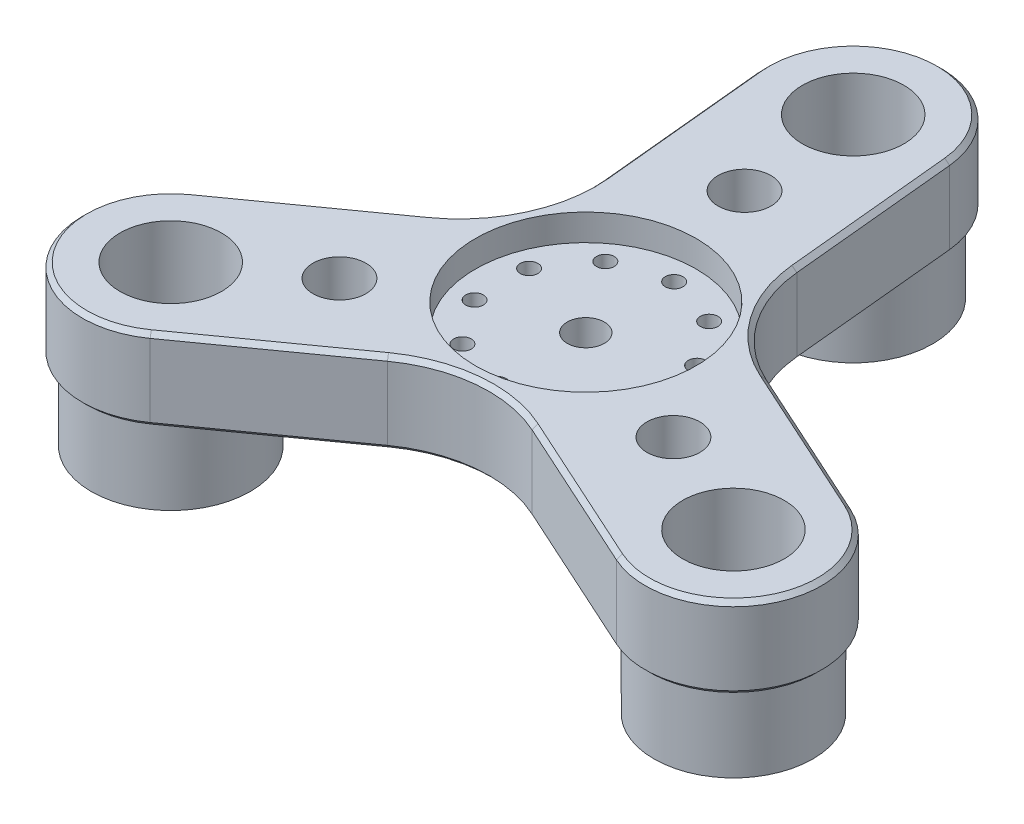
from build123d import *

# Parameters (mm, degrees)
SKETCH_1_R           = 10
EXTRUDE_1_DEPTH      = 9.25
CUT_EXTRUDE_1_REACH  = 62.295
SKETCH_2_R           = 4.5
SKETCH_3_R           = 9
EXTRUDE_2_DEPTH      = 9.5
CUT_EXTRUDE_2_REACH  = 62.334
SKETCH_4_R           = 4.5
FILLET_1_R           = 15
SKETCH_6_R           = 12.5
CUT_EXTRUDE_5_DEPTH  = 3
CHAMFER_1_SIZE       = 0.5
CHAMFER_2_SIZE       = 0.5
SKETCH_7_R           = 4.71
EXTRUDE_3_DEPTH      = 2.5
CUT_EXTRUDE_6_REACH  = 63.628
SKETCH_8_R           = 1
CUT_EXTRUDE_7_REACH  = 62.729
SKETCH_9_R           = 2.1
CUT_EXTRUDE_9_REACH  = 64.462
SKETCH_10_R          = 3
CUT_EXTRUDE_10_REACH = 64.462
SKETCH_11_R          = 5.75
CUT_EXTRUDE_START    = -0.75
SKETCH_12_R          = 9
SKETCH_12_R_2        = 5.75
CUT_EXTRUDE_11_DEPTH = 0.75


with BuildPart() as part:
    # ｽｹｯﾁ1 → ﾎﾞｽ - 押し出し1 (new body)
    with BuildSketch(Plane(origin=(0, 0, 0), x_dir=(1, 0, 0), z_dir=(0, 1, 0))):
        with Locations((-3.254321183, 33.539013848)):
            Circle(SKETCH_1_R)
        with BuildLine():
            ThreePointArc((6.745678817, 33.539013848), (-2.770869168, 23.550706977), (-13.207576013, 32.57324043))
            Line((-13.207576013, 32.57324043), (-10.510844372, 4.780740937))
            Line((-10.510844372, 4.780740937), (-33.231489148, -11.450946917))
            ThreePointArc((-33.231489148, -11.450946917), (-22.84300571, -10.695978242), (-17.418477419, -19.587831741))
            ThreePointArc((-17.418477419, -19.587831741), (-18.52662392, -24.163303449), (-21.60546569, -27.724716565))
            Line((-21.60546569, -27.724716565), (1.115179086, -11.493028711))
            Line((1.115179086, -11.493028711), (26.532555501, -23.053840349))
            ThreePointArc((26.532555501, -23.053840349), (21.57014036, -9.810939007), (34.813041703, -4.848523866))
            Line((34.813041703, -4.848523866), (9.395665287, 6.712287773))
            Line((9.395665287, 6.712287773), (6.698933646, 34.504787266))
            ThreePointArc((6.698933646, 34.504787266), (6.733985688, 34.022465864), (6.745678817, 33.539013848))
        make_face()
        with Locations((30.672798602, -13.951182107)):
            Circle(SKETCH_1_R)
        with Locations((-27.418477419, -19.587831741)):
            Circle(SKETCH_1_R)
    extrude(amount=EXTRUDE_1_DEPTH)

    # ｽｹｯﾁ2 → ｶｯﾄ - 押し出し1 (cut, up to next)
    with BuildSketch(Plane(origin=(0, 9.25, 0), x_dir=(1, 0, 0), z_dir=(0, 1, 0)), mode=Mode.PRIVATE) as cut_extrude_1_sk1:
        with Locations(Location((-27.418477419, -19.587831741, 0), (0, 0, 270))):
            Circle(SKETCH_2_R)
    cut_extrude_1_tool1 = extrude(cut_extrude_1_sk1.sketch, amount=-CUT_EXTRUDE_1_REACH, mode=Mode.PRIVATE) & part.part
    # ｽｹｯﾁ2 → ｶｯﾄ - 押し出し1 (cut, up to next)
    with BuildSketch(Plane(origin=(0, 9.25, 0), x_dir=(1, 0, 0), z_dir=(0, 1, 0)), mode=Mode.PRIVATE) as cut_extrude_1_sk2:
        with Locations(Location((-3.254321183, 33.539013848, 0), (0, 0, 270))):
            Circle(SKETCH_2_R)
    cut_extrude_1_tool2 = extrude(cut_extrude_1_sk2.sketch, amount=-CUT_EXTRUDE_1_REACH, mode=Mode.PRIVATE) & part.part
    # ｽｹｯﾁ2 → ｶｯﾄ - 押し出し1 (cut, up to next)
    with BuildSketch(Plane(origin=(0, 9.25, 0), x_dir=(1, 0, 0), z_dir=(0, 1, 0)), mode=Mode.PRIVATE) as cut_extrude_1_sk3:
        with Locations(Location((30.672798602, -13.951182107, 0), (0, 0, 270))):
            Circle(SKETCH_2_R)
    cut_extrude_1_tool3 = extrude(cut_extrude_1_sk3.sketch, amount=-CUT_EXTRUDE_1_REACH, mode=Mode.PRIVATE) & part.part
    add(cut_extrude_1_tool1.solids().sort_by_distance((-27.418477, 9.25, 19.587832))[0], mode=Mode.SUBTRACT)
    add(cut_extrude_1_tool2.solids().sort_by_distance((-3.254321, 9.25, -33.539014))[0], mode=Mode.SUBTRACT)
    add(cut_extrude_1_tool3.solids().sort_by_distance((30.672799, 9.25, 13.951182))[0], mode=Mode.SUBTRACT)

    # ｽｹｯﾁ3 → ﾎﾞｽ - 押し出し2 (add)
    with BuildSketch(Plane.XZ):
        with Locations(Location((-3.254321183, -33.539013848, 0), (0, 0, 90))):
            Circle(SKETCH_3_R)
        with Locations(Location((-27.418477419, 19.587831741, 0), (0, 0, 90))):
            Circle(SKETCH_3_R)
        with Locations(Location((30.672798602, 13.951182107, 0), (0, 0, 90))):
            Circle(SKETCH_3_R)
    extrude(amount=EXTRUDE_2_DEPTH)

    # ｽｹｯﾁ4 → ｶｯﾄ - 押し出し2 (cut, up to next)
    with BuildSketch(Plane(origin=(0, 0, 0), x_dir=(1, 0, 0), z_dir=(0, 1, 0)), mode=Mode.PRIVATE) as cut_extrude_2_sk1:
        with Locations(Location((-3.254321183, 33.539013848, 0), (0, 0, 270))):
            Circle(SKETCH_4_R)
    cut_extrude_2_tool1 = extrude(cut_extrude_2_sk1.sketch, amount=-CUT_EXTRUDE_2_REACH, mode=Mode.PRIVATE) & part.part
    # ｽｹｯﾁ4 → ｶｯﾄ - 押し出し2 (cut, up to next)
    with BuildSketch(Plane(origin=(0, 0, 0), x_dir=(1, 0, 0), z_dir=(0, 1, 0)), mode=Mode.PRIVATE) as cut_extrude_2_sk2:
        with Locations(Location((30.672798602, -13.951182107, 0), (0, 0, 270))):
            Circle(SKETCH_4_R)
    cut_extrude_2_tool2 = extrude(cut_extrude_2_sk2.sketch, amount=-CUT_EXTRUDE_2_REACH, mode=Mode.PRIVATE) & part.part
    # ｽｹｯﾁ4 → ｶｯﾄ - 押し出し2 (cut, up to next)
    with BuildSketch(Plane(origin=(0, 0, 0), x_dir=(1, 0, 0), z_dir=(0, 1, 0)), mode=Mode.PRIVATE) as cut_extrude_2_sk3:
        with Locations(Location((-27.418477419, -19.587831741, 0), (0, 0, 270))):
            Circle(SKETCH_4_R)
    cut_extrude_2_tool3 = extrude(cut_extrude_2_sk3.sketch, amount=-CUT_EXTRUDE_2_REACH, mode=Mode.PRIVATE) & part.part
    add(cut_extrude_2_tool1.solids().sort_by_distance((-3.254321, 0, -33.539014))[0], mode=Mode.SUBTRACT)
    add(cut_extrude_2_tool2.solids().sort_by_distance((30.672799, 0, 13.951182))[0], mode=Mode.SUBTRACT)
    add(cut_extrude_2_tool3.solids().sort_by_distance((-27.418477, 0, 19.587832))[0], mode=Mode.SUBTRACT)

    # ﾌｨﾚｯﾄ1
    fillet_1_edges = [part.edges().sort_by_distance(p)[0] for p in [
        (9.395665287, 4.625, -6.712287773),
        (1.115179086, 4.625, 11.493028711),
        (-10.510844372, 4.625, -4.780740937),
    ]]
    fillet(fillet_1_edges, radius=FILLET_1_R)

    # ｽｹｯﾁ6 → ｶｯﾄ - 押し出し5 (cut)
    with BuildSketch(Plane(origin=(0, 9.25, 0), x_dir=(1, 0, 0), z_dir=(0, 1, 0))):
        with Locations(Location((0, 0, 0), (0, 0, 270))):
            Circle(SKETCH_6_R)
    extrude(amount=-CUT_EXTRUDE_5_DEPTH, mode=Mode.SUBTRACT)

    # 面取り1
    chamfer_1_edges = [part.edges().sort_by_distance(p)[0] for p in [
        (-12.27740235, 9.25, -22.98687645),
        (-25.394541243, 9.25, 5.852210905),
        (-35.555362243, 9.25, 25.40084347),
        (-13.768517785, 9.25, 22.125980553),
        (17.765433933, 9.25, 19.066212381),
        (39.775456844, 9.25, 18.091425208),
        (26.045920135, 9.25, 0.860895898),
        (7.62910731, 9.25, -24.918423286),
        (-4.220094601, 9.25, -43.492268678),
        (11.283835981, 9.25, -8.061201839),
        (1.339287587, 9.25, 13.802689532),
        (-12.623123569, 9.25, -5.741487692),
    ]]
    chamfer(chamfer_1_edges, length=CHAMFER_1_SIZE)

    # 面取り2
    chamfer_2_edges = [part.edges().sort_by_distance(p)[0] for p in [
        (39.775456844, 0, 18.091425208),
        (17.765433933, 0, 19.066212381),
        (-13.768517785, 0, 22.125980553),
        (-35.555362243, 0, 25.40084347),
        (-25.394541243, 0, 5.852210905),
        (-12.27740235, 0, -22.98687645),
        (-4.220094601, 0, -43.492268678),
        (7.62910731, 0, -24.918423286),
        (11.283835981, 0, -8.061201839),
        (1.339287587, 0, 13.802689532),
        (-12.623123569, 0, -5.741487692),
        (26.045920135, 0, 0.860895898),
    ]]
    chamfer(chamfer_2_edges, length=CHAMFER_2_SIZE)

    # ｽｹｯﾁ7 → ﾎﾞｽ - 押し出し3 (add)
    with BuildSketch(Plane.XZ):
        with Locations(Location((0, 0, 0), (0, 0, 90))):
            Circle(SKETCH_7_R)
    extrude(amount=EXTRUDE_3_DEPTH)

    # ｽｹｯﾁ8 → ｶｯﾄ - 押し出し6 (cut, up to next)
    with BuildSketch(Plane(origin=(0, 6.25, 0), x_dir=(1, 0, 0), z_dir=(0, 1, 0)), mode=Mode.PRIVATE) as cut_extrude_6_sk1:
        with Locations(Location((0, 10, 0), (0, 0, 270))):
            Circle(SKETCH_8_R)
    cut_extrude_6_tool1 = extrude(cut_extrude_6_sk1.sketch, amount=-CUT_EXTRUDE_6_REACH, mode=Mode.PRIVATE) & part.part
    # ｽｹｯﾁ8 → ｶｯﾄ - 押し出し6 (cut, up to next)
    with BuildSketch(Plane(origin=(0, 6.25, 0), x_dir=(1, 0, 0), z_dir=(0, 1, 0)), mode=Mode.PRIVATE) as cut_extrude_6_sk2:
        with Locations(Location((5.877852523, 8.090169944, 0), (0, 0, 270))):
            Circle(SKETCH_8_R)
    cut_extrude_6_tool2 = extrude(cut_extrude_6_sk2.sketch, amount=-CUT_EXTRUDE_6_REACH, mode=Mode.PRIVATE) & part.part
    # ｽｹｯﾁ8 → ｶｯﾄ - 押し出し6 (cut, up to next)
    with BuildSketch(Plane(origin=(0, 6.25, 0), x_dir=(1, 0, 0), z_dir=(0, 1, 0)), mode=Mode.PRIVATE) as cut_extrude_6_sk3:
        with Locations(Location((9.510565163, 3.090169944, 0), (0, 0, 270))):
            Circle(SKETCH_8_R)
    cut_extrude_6_tool3 = extrude(cut_extrude_6_sk3.sketch, amount=-CUT_EXTRUDE_6_REACH, mode=Mode.PRIVATE) & part.part
    # ｽｹｯﾁ8 → ｶｯﾄ - 押し出し6 (cut, up to next)
    with BuildSketch(Plane(origin=(0, 6.25, 0), x_dir=(1, 0, 0), z_dir=(0, 1, 0)), mode=Mode.PRIVATE) as cut_extrude_6_sk4:
        with Locations(Location((9.510565163, -3.090169944, 0), (0, 0, 270))):
            Circle(SKETCH_8_R)
    cut_extrude_6_tool4 = extrude(cut_extrude_6_sk4.sketch, amount=-CUT_EXTRUDE_6_REACH, mode=Mode.PRIVATE) & part.part
    # ｽｹｯﾁ8 → ｶｯﾄ - 押し出し6 (cut, up to next)
    with BuildSketch(Plane(origin=(0, 6.25, 0), x_dir=(1, 0, 0), z_dir=(0, 1, 0)), mode=Mode.PRIVATE) as cut_extrude_6_sk5:
        with Locations(Location((5.877852523, -8.090169944, 0), (0, 0, 270))):
            Circle(SKETCH_8_R)
    cut_extrude_6_tool5 = extrude(cut_extrude_6_sk5.sketch, amount=-CUT_EXTRUDE_6_REACH, mode=Mode.PRIVATE) & part.part
    # ｽｹｯﾁ8 → ｶｯﾄ - 押し出し6 (cut, up to next)
    with BuildSketch(Plane(origin=(0, 6.25, 0), x_dir=(1, 0, 0), z_dir=(0, 1, 0)), mode=Mode.PRIVATE) as cut_extrude_6_sk6:
        with Locations(Location((0, -10, 0), (0, 0, 270))):
            Circle(SKETCH_8_R)
    cut_extrude_6_tool6 = extrude(cut_extrude_6_sk6.sketch, amount=-CUT_EXTRUDE_6_REACH, mode=Mode.PRIVATE) & part.part
    # ｽｹｯﾁ8 → ｶｯﾄ - 押し出し6 (cut, up to next)
    with BuildSketch(Plane(origin=(0, 6.25, 0), x_dir=(1, 0, 0), z_dir=(0, 1, 0)), mode=Mode.PRIVATE) as cut_extrude_6_sk7:
        with Locations(Location((-5.877852523, -8.090169944, 0), (0, 0, 270))):
            Circle(SKETCH_8_R)
    cut_extrude_6_tool7 = extrude(cut_extrude_6_sk7.sketch, amount=-CUT_EXTRUDE_6_REACH, mode=Mode.PRIVATE) & part.part
    # ｽｹｯﾁ8 → ｶｯﾄ - 押し出し6 (cut, up to next)
    with BuildSketch(Plane(origin=(0, 6.25, 0), x_dir=(1, 0, 0), z_dir=(0, 1, 0)), mode=Mode.PRIVATE) as cut_extrude_6_sk8:
        with Locations(Location((-9.510565163, -3.090169944, 0), (0, 0, 270))):
            Circle(SKETCH_8_R)
    cut_extrude_6_tool8 = extrude(cut_extrude_6_sk8.sketch, amount=-CUT_EXTRUDE_6_REACH, mode=Mode.PRIVATE) & part.part
    # ｽｹｯﾁ8 → ｶｯﾄ - 押し出し6 (cut, up to next)
    with BuildSketch(Plane(origin=(0, 6.25, 0), x_dir=(1, 0, 0), z_dir=(0, 1, 0)), mode=Mode.PRIVATE) as cut_extrude_6_sk9:
        with Locations(Location((-9.510565163, 3.090169944, 0), (0, 0, 270))):
            Circle(SKETCH_8_R)
    cut_extrude_6_tool9 = extrude(cut_extrude_6_sk9.sketch, amount=-CUT_EXTRUDE_6_REACH, mode=Mode.PRIVATE) & part.part
    # ｽｹｯﾁ8 → ｶｯﾄ - 押し出し6 (cut, up to next)
    with BuildSketch(Plane(origin=(0, 6.25, 0), x_dir=(1, 0, 0), z_dir=(0, 1, 0)), mode=Mode.PRIVATE) as cut_extrude_6_sk10:
        with Locations(Location((-5.877852523, 8.090169944, 0), (0, 0, 270))):
            Circle(SKETCH_8_R)
    cut_extrude_6_tool10 = extrude(cut_extrude_6_sk10.sketch, amount=-CUT_EXTRUDE_6_REACH, mode=Mode.PRIVATE) & part.part
    add(cut_extrude_6_tool1.solids().sort_by_distance((0, 6.25, -10))[0], mode=Mode.SUBTRACT)
    add(cut_extrude_6_tool2.solids().sort_by_distance((5.877853, 6.25, -8.09017))[0], mode=Mode.SUBTRACT)
    add(cut_extrude_6_tool3.solids().sort_by_distance((9.510565, 6.25, -3.09017))[0], mode=Mode.SUBTRACT)
    add(cut_extrude_6_tool4.solids().sort_by_distance((9.510565, 6.25, 3.09017))[0], mode=Mode.SUBTRACT)
    add(cut_extrude_6_tool5.solids().sort_by_distance((5.877853, 6.25, 8.09017))[0], mode=Mode.SUBTRACT)
    add(cut_extrude_6_tool6.solids().sort_by_distance((0, 6.25, 10))[0], mode=Mode.SUBTRACT)
    add(cut_extrude_6_tool7.solids().sort_by_distance((-5.877853, 6.25, 8.09017))[0], mode=Mode.SUBTRACT)
    add(cut_extrude_6_tool8.solids().sort_by_distance((-9.510565, 6.25, 3.09017))[0], mode=Mode.SUBTRACT)
    add(cut_extrude_6_tool9.solids().sort_by_distance((-9.510565, 6.25, -3.09017))[0], mode=Mode.SUBTRACT)
    add(cut_extrude_6_tool10.solids().sort_by_distance((-5.877853, 6.25, -8.09017))[0], mode=Mode.SUBTRACT)

    # ｽｹｯﾁ9 → ｶｯﾄ - 押し出し7 (cut, up to next)
    with BuildSketch(Plane.XZ.offset(2.5), mode=Mode.PRIVATE) as cut_extrude_7_sk1:
        with Locations(Location((0, 0, 0), (0, 0, 270))):
            Circle(SKETCH_9_R)
    cut_extrude_7_tool1 = extrude(cut_extrude_7_sk1.sketch, amount=-CUT_EXTRUDE_7_REACH, mode=Mode.PRIVATE) & part.part
    add(cut_extrude_7_tool1.solids().sort_by_distance((0, -2.5, 0))[0], mode=Mode.SUBTRACT)

    # ｽｹｯﾁ10 → ｶｯﾄ - 押し出し9 (cut, up to next)
    with BuildSketch(Plane(origin=(0, 9.25, 0), x_dir=(1, 0, 0), z_dir=(0, 1, 0)), mode=Mode.PRIVATE) as cut_extrude_9_sk1:
        with Locations(Location((-1.931546836, 19.906509659, 0), (0, 0, 270))):
            Circle(SKETCH_10_R)
    cut_extrude_9_tool1 = extrude(cut_extrude_9_sk1.sketch, amount=-CUT_EXTRUDE_9_REACH, mode=Mode.PRIVATE) & part.part
    # ｽｹｯﾁ10 → ｶｯﾄ - 押し出し9 (cut, up to next)
    with BuildSketch(Plane(origin=(0, 9.25, 0), x_dir=(1, 0, 0), z_dir=(0, 1, 0)), mode=Mode.PRIVATE) as cut_extrude_9_sk2:
        with Locations(Location((18.205316484, -8.280486201, 0), (0, 0, 270))):
            Circle(SKETCH_10_R)
    cut_extrude_9_tool2 = extrude(cut_extrude_9_sk2.sketch, amount=-CUT_EXTRUDE_9_REACH, mode=Mode.PRIVATE) & part.part
    # ｽｹｯﾁ10 → ｶｯﾄ - 押し出し9 (cut, up to next)
    with BuildSketch(Plane(origin=(0, 9.25, 0), x_dir=(1, 0, 0), z_dir=(0, 1, 0)), mode=Mode.PRIVATE) as cut_extrude_9_sk3:
        with Locations(Location((-16.273769648, -11.626023458, 0), (0, 0, 270))):
            Circle(SKETCH_10_R)
    cut_extrude_9_tool3 = extrude(cut_extrude_9_sk3.sketch, amount=-CUT_EXTRUDE_9_REACH, mode=Mode.PRIVATE) & part.part
    add(cut_extrude_9_tool1.solids().sort_by_distance((-1.931547, 9.25, -19.90651))[0], mode=Mode.SUBTRACT)
    add(cut_extrude_9_tool2.solids().sort_by_distance((18.205316, 9.25, 8.280486))[0], mode=Mode.SUBTRACT)
    add(cut_extrude_9_tool3.solids().sort_by_distance((-16.27377, 9.25, 11.626023))[0], mode=Mode.SUBTRACT)

    # ｽｹｯﾁ11 → ｶｯﾄ - 押し出し10 (cut, up to next)
    with BuildSketch(Plane(origin=(0, 9.25, 0), x_dir=(1, 0, 0), z_dir=(0, 1, 0)), mode=Mode.PRIVATE) as cut_extrude_10_sk1:
        with Locations(Location((-3.254321183, 33.539013848, 0), (0, 0, 270))):
            Circle(SKETCH_11_R)
    cut_extrude_10_tool1 = extrude(cut_extrude_10_sk1.sketch, amount=-CUT_EXTRUDE_10_REACH, mode=Mode.PRIVATE) & part.part
    # ｽｹｯﾁ11 → ｶｯﾄ - 押し出し10 (cut, up to next)
    with BuildSketch(Plane(origin=(0, 9.25, 0), x_dir=(1, 0, 0), z_dir=(0, 1, 0)), mode=Mode.PRIVATE) as cut_extrude_10_sk2:
        with Locations(Location((30.672798602, -13.951182107, 0), (0, 0, 270))):
            Circle(SKETCH_11_R)
    cut_extrude_10_tool2 = extrude(cut_extrude_10_sk2.sketch, amount=-CUT_EXTRUDE_10_REACH, mode=Mode.PRIVATE) & part.part
    # ｽｹｯﾁ11 → ｶｯﾄ - 押し出し10 (cut, up to next)
    with BuildSketch(Plane(origin=(0, 9.25, 0), x_dir=(1, 0, 0), z_dir=(0, 1, 0)), mode=Mode.PRIVATE) as cut_extrude_10_sk3:
        with Locations(Location((-27.418477419, -19.587831741, 0), (0, 0, 270))):
            Circle(SKETCH_11_R)
    cut_extrude_10_tool3 = extrude(cut_extrude_10_sk3.sketch, amount=-CUT_EXTRUDE_10_REACH, mode=Mode.PRIVATE) & part.part
    add(cut_extrude_10_tool1.solids().sort_by_distance((-3.254321, 9.25, -33.539014))[0], mode=Mode.SUBTRACT)
    add(cut_extrude_10_tool2.solids().sort_by_distance((30.672799, 9.25, 13.951182))[0], mode=Mode.SUBTRACT)
    add(cut_extrude_10_tool3.solids().sort_by_distance((-27.418477, 9.25, 19.587832))[0], mode=Mode.SUBTRACT)

    # ｽｹｯﾁ12 → ｶｯﾄ - 押し出し11 (cut)
    # profile 1 of 3: a face of its own
    with BuildSketch(Plane(origin=(0, -9.5, 0), x_dir=(-1, 0, 0), z_dir=(0, -1, 0)).offset(CUT_EXTRUDE_START)):
        with Locations(Location((3.254321183, 33.539013848, 0), (0, 0, 270))):
            Circle(SKETCH_12_R)
        with Locations(Location((3.254321183, 33.539013848, 0), (0, 0, 270))):
            Circle(SKETCH_12_R_2, mode=Mode.SUBTRACT)
    # profile 2 of 3: a face of its own
    with BuildSketch(Plane(origin=(0, -9.5, 0), x_dir=(-1, 0, 0), z_dir=(0, -1, 0)).offset(CUT_EXTRUDE_START)):
        with Locations(Location((27.418477419, -19.587831741, 0), (0, 0, 270))):
            Circle(SKETCH_12_R)
    # profile 3 of 3: a face of its own
    with BuildSketch(Plane(origin=(0, -9.5, 0), x_dir=(-1, 0, 0), z_dir=(0, -1, 0)).offset(CUT_EXTRUDE_START)):
        with Locations(Location((-30.672798602, -13.951182107, 0), (0, 0, 270))):
            Circle(SKETCH_12_R)
    extrude(amount=CUT_EXTRUDE_11_DEPTH, mode=Mode.SUBTRACT)


solid = part.part
